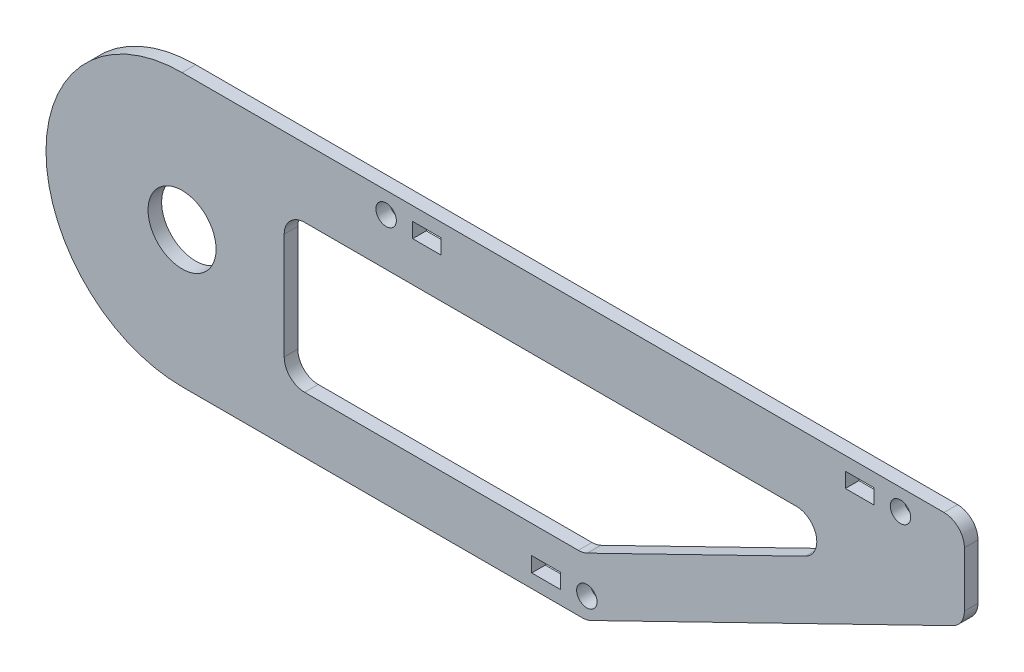
from build123d import *

# Parameters (mm, degrees)
SKETCH_1_R      = 5
SKETCH_1_R_2    = 1.5
SKETCH_1_W      = 4.2
SKETCH_1_H      = 2.2
EXTRUDE_1_DEPTH = 2


with BuildPart() as part:
    # 草图1 → 凸台-拉伸1 (new body)
    with BuildSketch(Plane.XY):
        with BuildLine():
            Line((0, 20), (112, 20))
            ThreePointArc((112, 20), (114.121320344, 19.121320344), (115, 17))
            Line((115, 17), (115, 8.938182396))
            ThreePointArc((115, 8.938182396), (114.544077651, 7.348317965), (113.314887395, 6.241690019))
            Line((113.314887395, 6.241690019), (60.122415269, -19.696492377))
            ThreePointArc((60.122415269, -19.696492377), (59.482258513, -19.923138479), (58.807527874, -20))
            Line((58.807527874, -20), (0, -20))
            ThreePointArc((0, -20), (-20, 0), (0, 20))
        make_face()
        Circle(SKETCH_1_R, mode=Mode.SUBTRACT)
        with Locations(Location((30, 16.9, 0), (0, 0, 180))):
            Circle(SKETCH_1_R_2, mode=Mode.SUBTRACT)
        with Locations(Location((105.6, 16.9, 0), (0, 0, 180))):
            Circle(SKETCH_1_R_2, mode=Mode.SUBTRACT)
        with Locations((59.5, -16.9)):
            Circle(SKETCH_1_R_2, mode=Mode.SUBTRACT)
        with BuildLine():
            Line((59.567545449, -11.393906383), (91.618526066, 4.235075463))
            ThreePointArc((91.618526066, 4.235075463), (93.22677715, 7.606298478), (90.303638671, 9.93156784))
            Line((90.303638671, 9.93156784), (18.013127748, 9.93156784))
            ThreePointArc((18.013127748, 9.93156784), (15.891807404, 9.052888183), (15.013127748, 6.93156784))
            Line((15.013127748, 6.93156784), (15.013127748, -8.697414007))
            ThreePointArc((15.013127748, -8.697414007), (15.891807404, -10.81873435), (18.013127748, -11.697414007))
            Line((18.013127748, -11.697414007), (58.252658054, -11.697414007))
            ThreePointArc((58.252658054, -11.697414007), (58.927388693, -11.620552485), (59.567545449, -11.393906383))
        make_face(mode=Mode.SUBTRACT)
        with Locations((99.6, 16.9)):
            Rectangle(SKETCH_1_W, SKETCH_1_H, mode=Mode.SUBTRACT)
        with Locations((36, 16.9)):
            Rectangle(SKETCH_1_W, SKETCH_1_H, mode=Mode.SUBTRACT)
        with Locations((53.5, -16.9)):
            Rectangle(SKETCH_1_W, SKETCH_1_H, mode=Mode.SUBTRACT)
    extrude(amount=EXTRUDE_1_DEPTH)


solid = part.part
